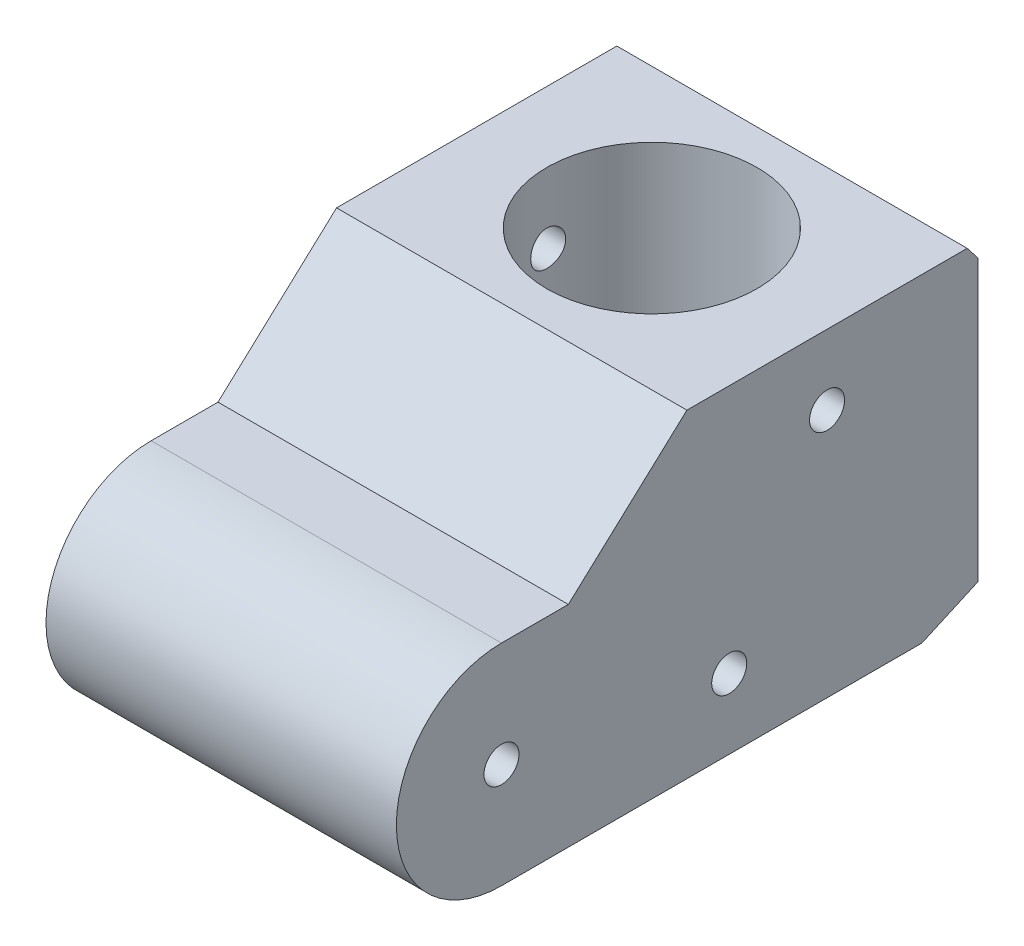
from build123d import *

# Parameters (mm, degrees)
SKETCH1_W           = 120
SKETCH1_H           = 60
BOSS_EXTRUDE1_DEPTH = 100
SKETCH2_R           = 40
CUT_EXTRUDE1_DEPTH  = 30
SKETCH3_R           = 5
CUT_EXTRUDE2_DEPTH  = 121.415945788
BOSS_EXTRUDE2_DEPTH = 100
SKETCH9_R           = 30
CUT_EXTRUDE6_DEPTH  = 50
SKETCH5_R           = 5
CUT_EXTRUDE3_DEPTH  = 100


with BuildPart() as part:
    # Sketch1 → Boss-Extrude1 (new body)
    with BuildSketch(Plane(origin=(0, 0, 0), x_dir=(0, 0, -1), z_dir=(1, 0, 0))):
        Rectangle(SKETCH1_W, SKETCH1_H)
    extrude(amount=-BOSS_EXTRUDE1_DEPTH)

    # Sketch2 → Cut-Extrude1 (cut)
    with BuildSketch(Plane.XZ.offset(30)):
        with Locations(Location((-50, -5, 0), (0, 0, 270))):
            Circle(SKETCH2_R)
    extrude(amount=-CUT_EXTRUDE1_DEPTH, mode=Mode.SUBTRACT)

    # Sketch3 → Cut-Extrude2 (cut, through all)
    with BuildSketch(Plane(origin=(0, 0, 0), x_dir=(0, 0, -1), z_dir=(1, 0, 0))):
        with Locations((5, -10)):
            Circle(SKETCH3_R)
    extrude(amount=-CUT_EXTRUDE2_DEPTH, mode=Mode.SUBTRACT)

    # Sketch4 → Boss-Extrude2 (add)
    with BuildSketch(Plane(origin=(0, 0, 0), x_dir=(0, 0, -1), z_dir=(1, 0, 0))):
        with BuildLine():
            Line((-60, 30), (-60, -30))
            ThreePointArc((-60, -30), (-90, 0), (-60, 30))
        make_face()
        Polygon((60, 30), (60, -30), (76, -22.836697104), (76, 57.163302896), (72.921242275, 61.103004772), (-7.078757725, 61.103004772), (-40.915642919, 30), align=None)
    extrude(amount=-BOSS_EXTRUDE2_DEPTH)

    # Sketch9 → Cut-Extrude6 (cut)
    with BuildSketch(Plane(origin=(0, 61.103004772, 0), x_dir=(1, 0, 0), z_dir=(0, 1, 0))):
        with Locations(Location((-50, 32.921242275, 0), (0, 0, 270))):
            Circle(SKETCH9_R)
    extrude(amount=-CUT_EXTRUDE6_DEPTH, mode=Mode.SUBTRACT)

    # Sketch5 → Cut-Extrude3 (cut)
    with BuildSketch(Plane(origin=(0, 0, 0), x_dir=(0, 0, -1), z_dir=(1, 0, 0))):
        with Locations((-60, 0)):
            Circle(SKETCH5_R)
        with Locations((32.921242275, 41.103004772)):
            Circle(SKETCH5_R)
    extrude(amount=-CUT_EXTRUDE3_DEPTH, mode=Mode.SUBTRACT)


solid = part.part
